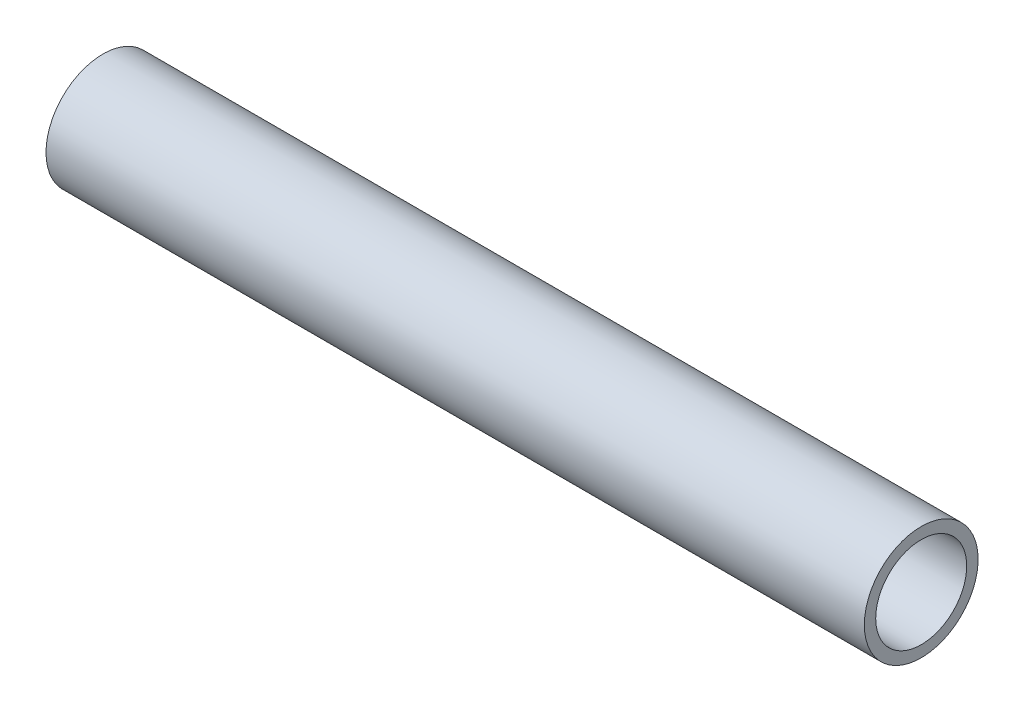
from build123d import *

# Parameters (mm, degrees)
SKETCH1_R           = 15.875
SKETCH1_R_2         = 12.7
EXTRUDE_THIN1_DEPTH = 114.173


with BuildPart() as part:
    # Sketch1 → Extrude-Thin1 (new, symmetric)
    with BuildSketch(Plane(origin=(0, 0, 0), x_dir=(0, 0, -1), z_dir=(1, 0, 0))):
        Circle(SKETCH1_R)
        Circle(SKETCH1_R_2, mode=Mode.SUBTRACT)
    extrude(amount=EXTRUDE_THIN1_DEPTH, both=True)


solid = part.part
